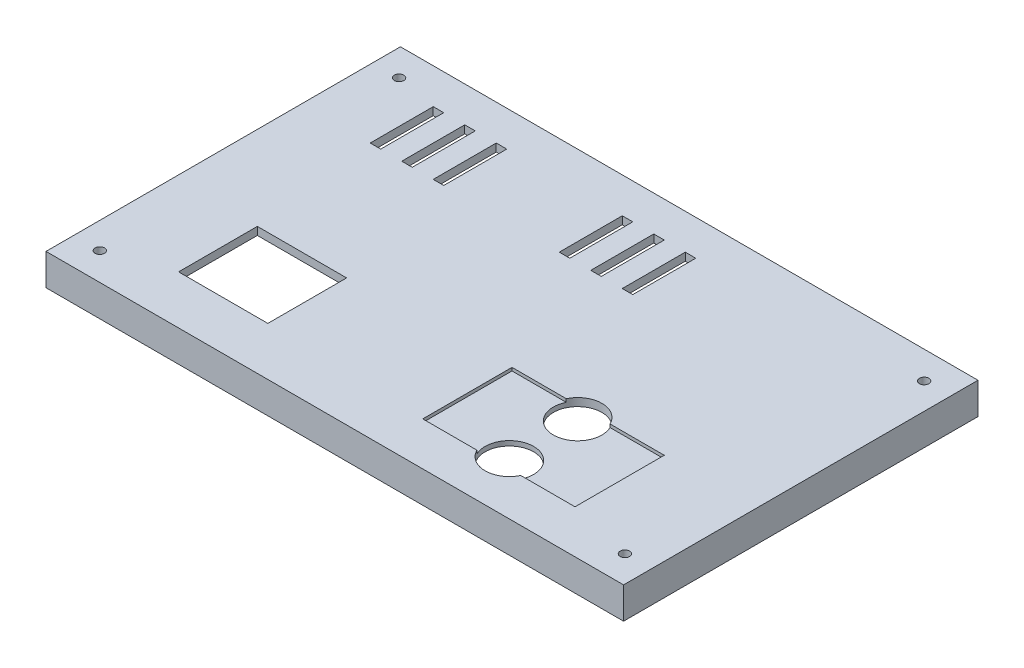
from build123d import *

# Parameters (mm, degrees)
SKETCH_1_W                       = 220
SKETCH_1_H                       = 135
LID_TOP_3MM_DEPTH                = 3
SKETCH_2_W                       = 216
SKETCH_2_H                       = 2
LID_RIM_BACK_DEPTH               = 12
SKETCH_3_W                       = 216
SKETCH_3_H                       = 2
LID_RIM_FRONT_DEPTH              = 12
SKETCH_4_W                       = 2
SKETCH_4_H                       = 135
LID_RIM_LEFT_DEPTH               = 12
SKETCH_5_W                       = 2
SKETCH_5_H                       = 135
LID_RIM_RIGHT_DEPTH              = 12
SKETCH_6_R                       = 1.8
LID_SCREW_CLEARANCE_1_DEPTH      = 16
SKETCH_7_R                       = 1.8
LID_SCREW_CLEARANCE_2_DEPTH      = 16
SKETCH_8_R                       = 1.8
LID_SCREW_CLEARANCE_3_DEPTH      = 16
SKETCH_9_R                       = 1.8
LID_SCREW_CLEARANCE_4_DEPTH      = 16
SKETCH_10_R                      = 9
OV5647_LENS_OPENING_D18_DEPTH    = 4
SKETCH_11_W                      = 34
SKETCH_11_H                      = 30
OV5647_SERVICE_CLEARANCE_DEPTH   = 4
SKETCH_12_R                      = 9.25
HC_SR04_ACOUSTIC_OPENING_1_DEPTH = 4
SKETCH_13_R                      = 9.25
HC_SR04_ACOUSTIC_OPENING_2_DEPTH = 4
SKETCH_14_W                      = 58
SKETCH_14_H                      = 34
HC_SR04_RECESS_DEPTH             = 1.2
SKETCH_15_W                      = 4
SKETCH_15_H                      = 24
VENT_SLOT_1_DEPTH                = 4
SKETCH_16_W                      = 4
SKETCH_16_H                      = 24
VENT_SLOT_2_DEPTH                = 4
SKETCH_17_W                      = 4
SKETCH_17_H                      = 24
VENT_SLOT_3_DEPTH                = 4
SKETCH_18_W                      = 4
SKETCH_18_H                      = 24
VENT_SLOT_4_DEPTH                = 4
SKETCH_19_W                      = 4
SKETCH_19_H                      = 24
VENT_SLOT_5_DEPTH                = 4
SKETCH_20_W                      = 4
SKETCH_20_H                      = 24
VENT_SLOT_6_DEPTH                = 4


with BuildPart() as part:
    # 草图1 → Lid_Top_3mm (new body)
    with BuildSketch(Plane(origin=(0, 0, 0), x_dir=(1, 0, 0), z_dir=(0, 1, 0))):
        Rectangle(SKETCH_1_W, SKETCH_1_H)
    extrude(amount=-LID_TOP_3MM_DEPTH)

    # 草图2 → Lid_Rim_Back (add)
    with BuildSketch(Plane(origin=(0, 0, 0), x_dir=(1, 0, 0), z_dir=(0, 1, 0))):
        with Locations((0, 66.5)):
            Rectangle(SKETCH_2_W, SKETCH_2_H)
    extrude(amount=-LID_RIM_BACK_DEPTH)

    # 草图3 → Lid_Rim_Front (add)
    with BuildSketch(Plane(origin=(0, 0, 0), x_dir=(1, 0, 0), z_dir=(0, 1, 0))):
        with Locations((0, -66.5)):
            Rectangle(SKETCH_3_W, SKETCH_3_H)
    extrude(amount=-LID_RIM_FRONT_DEPTH)

    # 草图4 → Lid_Rim_Left (add)
    with BuildSketch(Plane(origin=(0, 0, 0), x_dir=(1, 0, 0), z_dir=(0, 1, 0))):
        with Locations((-109, 0)):
            Rectangle(SKETCH_4_W, SKETCH_4_H)
    extrude(amount=-LID_RIM_LEFT_DEPTH)

    # 草图5 → Lid_Rim_Right (add)
    with BuildSketch(Plane(origin=(0, 0, 0), x_dir=(1, 0, 0), z_dir=(0, 1, 0))):
        with Locations((109, 0)):
            Rectangle(SKETCH_5_W, SKETCH_5_H)
    extrude(amount=-LID_RIM_RIGHT_DEPTH)

    # 草图6 → Lid_Screw_Clearance_1 (cut)
    with BuildSketch(Plane(origin=(0, 0, 0), x_dir=(1, 0, 0), z_dir=(0, 1, 0))):
        with Locations(Location((-100, -57, 0), (0, 0, 270))):
            Circle(SKETCH_6_R)
    extrude(amount=-LID_SCREW_CLEARANCE_1_DEPTH, mode=Mode.SUBTRACT)

    # 草图7 → Lid_Screw_Clearance_2 (cut)
    with BuildSketch(Plane(origin=(0, 0, 0), x_dir=(1, 0, 0), z_dir=(0, 1, 0))):
        with Locations(Location((100, -57, 0), (0, 0, 270))):
            Circle(SKETCH_7_R)
    extrude(amount=-LID_SCREW_CLEARANCE_2_DEPTH, mode=Mode.SUBTRACT)

    # 草图8 → Lid_Screw_Clearance_3 (cut)
    with BuildSketch(Plane(origin=(0, 0, 0), x_dir=(1, 0, 0), z_dir=(0, 1, 0))):
        with Locations(Location((-100, 57, 0), (0, 0, 270))):
            Circle(SKETCH_8_R)
    extrude(amount=-LID_SCREW_CLEARANCE_3_DEPTH, mode=Mode.SUBTRACT)

    # 草图9 → Lid_Screw_Clearance_4 (cut)
    with BuildSketch(Plane(origin=(0, 0, 0), x_dir=(1, 0, 0), z_dir=(0, 1, 0))):
        with Locations(Location((100, 57, 0), (0, 0, 270))):
            Circle(SKETCH_9_R)
    extrude(amount=-LID_SCREW_CLEARANCE_4_DEPTH, mode=Mode.SUBTRACT)

    # 草图10 → OV5647_Lens_Opening_D18 (cut)
    with BuildSketch(Plane(origin=(0, 0, 0), x_dir=(1, 0, 0), z_dir=(0, 1, 0))):
        with Locations(Location((-61, -34, 0), (0, 0, 270))):
            Circle(SKETCH_10_R)
    extrude(amount=-OV5647_LENS_OPENING_D18_DEPTH, mode=Mode.SUBTRACT)

    # 草图11 → OV5647_Service_Clearance (cut)
    with BuildSketch(Plane(origin=(0, 0, 0), x_dir=(1, 0, 0), z_dir=(0, 1, 0))):
        with Locations((-61, -34)):
            Rectangle(SKETCH_11_W, SKETCH_11_H)
    extrude(amount=-OV5647_SERVICE_CLEARANCE_DEPTH, mode=Mode.SUBTRACT)

    # 草图12 → HC_SR04_Acoustic_Opening_1 (cut)
    with BuildSketch(Plane(origin=(0, 0, 0), x_dir=(1, 0, 0), z_dir=(0, 1, 0))):
        with Locations(Location((46, -47, 0), (0, 0, 270))):
            Circle(SKETCH_12_R)
    extrude(amount=-HC_SR04_ACOUSTIC_OPENING_1_DEPTH, mode=Mode.SUBTRACT)

    # 草图13 → HC_SR04_Acoustic_Opening_2 (cut)
    with BuildSketch(Plane(origin=(0, 0, 0), x_dir=(1, 0, 0), z_dir=(0, 1, 0))):
        with Locations(Location((46, -21, 0), (0, 0, 270))):
            Circle(SKETCH_13_R)
    extrude(amount=-HC_SR04_ACOUSTIC_OPENING_2_DEPTH, mode=Mode.SUBTRACT)

    # 草图14 → HC_SR04_Recess (cut)
    with BuildSketch(Plane(origin=(0, 0, 0), x_dir=(1, 0, 0), z_dir=(0, 1, 0))):
        with Locations((46, -34)):
            Rectangle(SKETCH_14_W, SKETCH_14_H)
    extrude(amount=-HC_SR04_RECESS_DEPTH, mode=Mode.SUBTRACT)

    # 草图15 → Vent_Slot_1 (cut)
    with BuildSketch(Plane(origin=(0, 0, 0), x_dir=(1, 0, 0), z_dir=(0, 1, 0))):
        with Locations((-82, 42)):
            Rectangle(SKETCH_15_W, SKETCH_15_H)
    extrude(amount=-VENT_SLOT_1_DEPTH, mode=Mode.SUBTRACT)

    # 草图16 → Vent_Slot_2 (cut)
    with BuildSketch(Plane(origin=(0, 0, 0), x_dir=(1, 0, 0), z_dir=(0, 1, 0))):
        with Locations((-70, 42)):
            Rectangle(SKETCH_16_W, SKETCH_16_H)
    extrude(amount=-VENT_SLOT_2_DEPTH, mode=Mode.SUBTRACT)

    # 草图17 → Vent_Slot_3 (cut)
    with BuildSketch(Plane(origin=(0, 0, 0), x_dir=(1, 0, 0), z_dir=(0, 1, 0))):
        with Locations((-58, 42)):
            Rectangle(SKETCH_17_W, SKETCH_17_H)
    extrude(amount=-VENT_SLOT_3_DEPTH, mode=Mode.SUBTRACT)

    # 草图18 → Vent_Slot_4 (cut)
    with BuildSketch(Plane(origin=(0, 0, 0), x_dir=(1, 0, 0), z_dir=(0, 1, 0))):
        with Locations((-10, 42)):
            Rectangle(SKETCH_18_W, SKETCH_18_H)
    extrude(amount=-VENT_SLOT_4_DEPTH, mode=Mode.SUBTRACT)

    # 草图19 → Vent_Slot_5 (cut)
    with BuildSketch(Plane(origin=(0, 0, 0), x_dir=(1, 0, 0), z_dir=(0, 1, 0))):
        with Locations((2, 42)):
            Rectangle(SKETCH_19_W, SKETCH_19_H)
    extrude(amount=-VENT_SLOT_5_DEPTH, mode=Mode.SUBTRACT)

    # 草图20 → Vent_Slot_6 (cut)
    with BuildSketch(Plane(origin=(0, 0, 0), x_dir=(1, 0, 0), z_dir=(0, 1, 0))):
        with Locations((14, 42)):
            Rectangle(SKETCH_20_W, SKETCH_20_H)
    extrude(amount=-VENT_SLOT_6_DEPTH, mode=Mode.SUBTRACT)


solid = part.part
